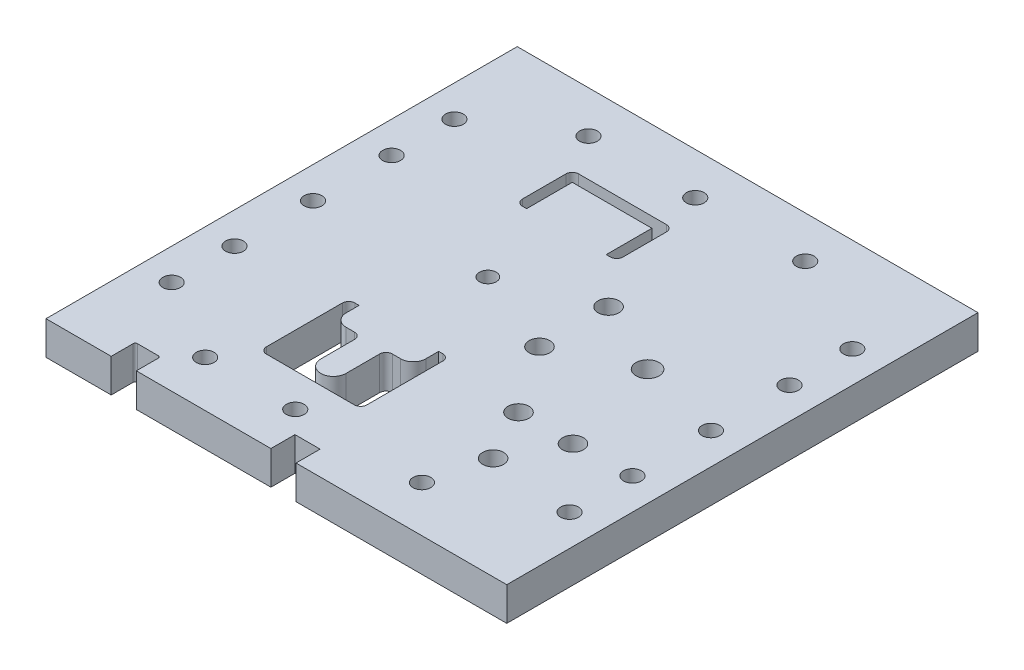
from build123d import *

# Parameters (mm, degrees)
SKETCH1_W              = 220
SKETCH1_H              = 225
BOSS_EXTRUDE1_DEPTH    = 16
CUT_EXTRUDE1_REACH     = 160.153
SKETCH2_R              = 4
CUT_EXTRUDE2_REACH     = 160.153
SKETCH3_W              = 12
SKETCH3_H              = 11.5
SKETCH4_R              = 8.5
CUT_EXTRUDE3_DEPTH     = 5
M10_TAPPED_HOLE2_D     = 8.5
M10_TAPPED_HOLE3_D     = 8.5
M10_TAPPED_HOLE4_D     = 8.5
CUT_EXTRUDE4_REACH     = 160.153
CUT_EXTRUDE6_REACH     = 160.153
F_10_0MM_DOWEL_HOLE1_D = 10
CUT_EXTRUDE7_REACH     = 160.153
SKETCH34_R             = 5


with BuildPart() as part:
    # Sketch1 → Boss-Extrude1 (new body)
    with BuildSketch(Plane(origin=(0, 0, 0), x_dir=(1, 0, 0), z_dir=(0, 1, 0))):
        Rectangle(SKETCH1_W, SKETCH1_H)
    extrude(amount=-BOSS_EXTRUDE1_DEPTH)

    # Sketch2 → Cut-Extrude1 (cut, up to next)
    with BuildSketch(Plane(origin=(0, 0, 0), x_dir=(1, 0, 0), z_dir=(0, 1, 0)), mode=Mode.PRIVATE) as cut_extrude1_sk1:
        with Locations(Location((-21.75, 10.23, 0), (0, 0, 270))):
            Circle(SKETCH2_R)
    cut_extrude1_tool1 = extrude(cut_extrude1_sk1.sketch, amount=-CUT_EXTRUDE1_REACH, mode=Mode.PRIVATE) & part.part
    add(cut_extrude1_tool1.solids().sort_by_distance((-21.75, 0, -10.23))[0], mode=Mode.SUBTRACT)

    # Sketch3 → Cut-Extrude2 (cut, up to next)
    with BuildSketch(Plane.XZ.offset(16), mode=Mode.PRIVATE) as cut_extrude2_sk1:
        with BuildLine():
            Line((-77.87, 101), (-67.87, 101))
            ThreePointArc((-67.87, 101), (-67.162893219, 101.292893219), (-66.87, 102))
            Line((-66.87, 102), (-66.87, 112.5))
            Line((-66.87, 112.5), (-78.87, 112.5))
            Line((-78.87, 112.5), (-78.87, 102))
            ThreePointArc((-78.87, 102), (-78.577106781, 101.292893219), (-77.87, 101))
        make_face()
    cut_extrude2_tool1 = extrude(cut_extrude2_sk1.sketch, amount=-CUT_EXTRUDE2_REACH, mode=Mode.PRIVATE) & part.part
    # Sketch3 → Cut-Extrude2 (cut, up to next)
    with BuildSketch(Plane.XZ.offset(16), mode=Mode.PRIVATE) as cut_extrude2_sk2:
        with Locations((3.38, 106.75)):
            Rectangle(SKETCH3_W, SKETCH3_H)
    cut_extrude2_tool2 = extrude(cut_extrude2_sk2.sketch, amount=-CUT_EXTRUDE2_REACH, mode=Mode.PRIVATE) & part.part
    add(cut_extrude2_tool1.solids().sort_by_distance((-72.87, -16, 106.767242))[0], mode=Mode.SUBTRACT)
    add(cut_extrude2_tool2.solids().sort_by_distance((3.38, -16, 106.75))[0], mode=Mode.SUBTRACT)

    # Sketch4 → Cut-Extrude3 (cut)
    with BuildSketch(Plane.XZ.offset(16)):
        with Locations(Location((-35, 100, 0), (0, 0, 270))):
            Circle(SKETCH4_R)
        with Locations(Location((25, 100, 0), (0, 0, 270))):
            Circle(SKETCH4_R)
        with Locations(Location((70, 100, 0), (0, 0, 270))):
            Circle(SKETCH4_R)
        with Locations(Location((-35, -100, 0), (0, 0, 270))):
            Circle(SKETCH4_R)
        with Locations(Location((25, -100, 0), (0, 0, 270))):
            Circle(SKETCH4_R)
        with Locations(Location((70, -100, 0), (0, 0, 270))):
            Circle(SKETCH4_R)
    extrude(amount=-CUT_EXTRUDE3_DEPTH, mode=Mode.SUBTRACT)

    # M10 Tapped Hole2 (through all)
    with Locations(Plane(origin=(0, 0, 0), x_dir=(1, 0, 0), z_dir=(0, 1, 0))):
        with Locations((-95, -67.5), (-95, -37.5), (-95, 0), (-95, 37.5), (-95, 67.5), (95, 67.5), (95, 37.5), (95, 0), (95, -37.5), (95, -67.5)):
            Hole(M10_TAPPED_HOLE2_D / 2)

    # M10 Tapped Hole3 (through all)
    with Locations(Plane(origin=(0, 0, 0), x_dir=(1, 0, 0), z_dir=(0, 1, 0))):
        with Locations((-56, 92.5), (-5, 92.5), (47.5, 92.5)):
            Hole(M10_TAPPED_HOLE3_D / 2)

    # M10 Tapped Hole4 (through all)
    with Locations(Plane(origin=(0, 0, 0), x_dir=(1, 0, 0), z_dir=(0, 1, 0))):
        with Locations((-13, -90.5), (47.5, -90.5), (-56, -90.5)):
            Hole(M10_TAPPED_HOLE4_D / 2)

    # Sketch24 → Cut-Extrude4 (cut, up to next)
    with BuildSketch(Plane(origin=(0, 0, 0), x_dir=(1, 0, 0), z_dir=(0, 1, 0)), mode=Mode.PRIVATE) as cut_extrude4_sk1:
        with BuildLine():
            Line((2.25, -35.27), (2.25, -71.53))
            ThreePointArc((2.25, -71.53), (1.371320344, -73.651320344), (-0.75, -74.53))
            Line((-0.75, -74.53), (-42.75, -74.53))
            ThreePointArc((-42.75, -74.53), (-44.871320344, -73.651320344), (-45.75, -71.53))
            Line((-45.75, -71.53), (-45.75, -35.27))
            ThreePointArc((-45.75, -35.27), (-44.871320344, -33.148679656), (-42.75, -32.27))
            Line((-42.75, -32.27), (-40.75, -32.27))
            Line((-40.75, -32.27), (-40.75, -38.4))
            ThreePointArc((-40.75, -38.4), (-38.992640687, -42.642640687), (-34.75, -44.4))
            Line((-34.75, -44.4), (-30.75, -44.4))
            ThreePointArc((-30.75, -44.4), (-28.628679656, -45.278679656), (-27.75, -47.4))
            Line((-27.75, -47.4), (-27.75, -63.53))
            ThreePointArc((-27.75, -63.53), (-21.75, -69.53), (-15.75, -63.53))
            Line((-15.75, -63.53), (-15.75, -47.4))
            ThreePointArc((-15.75, -47.4), (-14.871320344, -45.278679656), (-12.75, -44.4))
            Line((-12.75, -44.4), (-8.75, -44.4))
            ThreePointArc((-8.75, -44.4), (-4.507359313, -42.642640687), (-2.75, -38.4))
            Line((-2.75, -38.4), (-2.75, -32.27))
            Line((-2.75, -32.27), (-0.75, -32.27))
            ThreePointArc((-0.75, -32.27), (1.371320344, -33.148679656), (2.25, -35.27))
        make_face()
    cut_extrude4_tool1 = extrude(cut_extrude4_sk1.sketch, amount=-CUT_EXTRUDE4_REACH, mode=Mode.PRIVATE) & part.part
    add(cut_extrude4_tool1.solids().sort_by_distance((-15.110476, 0, 55.465))[0], mode=Mode.SUBTRACT)

    # Sketch29 → Cut-Extrude6 (cut, up to next)
    with BuildSketch(Plane.XZ.offset(16), mode=Mode.PRIVATE) as cut_extrude6_sk1:
        with BuildLine():
            Line((-2.75, -47.73), (-0.75, -47.73))
            ThreePointArc((-0.75, -47.73), (1.371320344, -48.608679656), (2.25, -50.73))
            Line((2.25, -50.73), (2.25, -71.53))
            ThreePointArc((2.25, -71.53), (1.371320344, -73.651320344), (-0.75, -74.53))
            Line((-0.75, -74.53), (-42.75, -74.53))
            ThreePointArc((-42.75, -74.53), (-44.871320344, -73.651320344), (-45.75, -71.53))
            Line((-45.75, -71.53), (-45.75, -50.73))
            ThreePointArc((-45.75, -50.73), (-44.871320344, -48.608679656), (-42.75, -47.73))
            Line((-42.75, -47.73), (-40.75, -47.73))
            Line((-40.75, -47.73), (-40.75, -69.53))
            Line((-40.75, -69.53), (-2.75, -69.53))
            Line((-2.75, -69.53), (-2.75, -47.73))
        make_face()
    cut_extrude6_tool1 = extrude(cut_extrude6_sk1.sketch, amount=-CUT_EXTRUDE6_REACH, mode=Mode.PRIVATE) & part.part
    add(cut_extrude6_tool1.solids().sort_by_distance((-1.75, -16, -48.279749))[0], mode=Mode.SUBTRACT)

    # Ø10.0mm Dowel Hole1 (through all)
    with Locations(Plane(origin=(0, 0, 0), x_dir=(1, 0, 0), z_dir=(0, 1, 0))):
        with Locations((54.5, -63.53), (67.5, -38.4), (41.5, -38.4), (19.38, 26.73), (19.38, -6.27)):
            Hole(F_10_0MM_DOWEL_HOLE1_D / 2)

    # Sketch34 → Cut-Extrude7 (cut, up to next)
    with BuildSketch(Plane(origin=(0, 0, 0), x_dir=(1, 0, 0), z_dir=(0, 1, 0)), mode=Mode.PRIVATE) as cut_extrude7_sk1:
        with Locations(Location((54.5, 10.23, 0), (0, 0, 270))):
            Circle(SKETCH34_R)
    cut_extrude7_tool1 = extrude(cut_extrude7_sk1.sketch, amount=-CUT_EXTRUDE7_REACH, mode=Mode.PRIVATE) & part.part
    add(cut_extrude7_tool1.solids().sort_by_distance((54.5, 0, -10.23))[0], mode=Mode.SUBTRACT)

    # Cut-Sweep1: sweep along a curve in space
    with BuildLine() as cut_sweep1_path:
        ThreePointArc((54.5, 0, -5.23), (58.035533906, 0, -6.694466094), (59.5, 0, -10.23))
        ThreePointArc((59.5, 0, -10.23), (58.035533906, 0, -13.765533906), (54.5, 0, -15.23))
        ThreePointArc((54.5, 0, -15.23), (50.964466094, 0, -13.765533906), (49.5, 0, -10.23))
        ThreePointArc((49.5, 0, -10.23), (50.964466094, 0, -6.694466094), (54.5, 0, -5.23))
    # Sketch35 → Cut-Sweep1 (sweep, cut)
    with BuildSketch(Plane.XY.offset(-10.23)):
        Polygon((59.5, -10), (60.024077793, 0), (59.5, 0), align=None)
    sweep(path=cut_sweep1_path.line, mode=Mode.SUBTRACT)


solid = part.part
